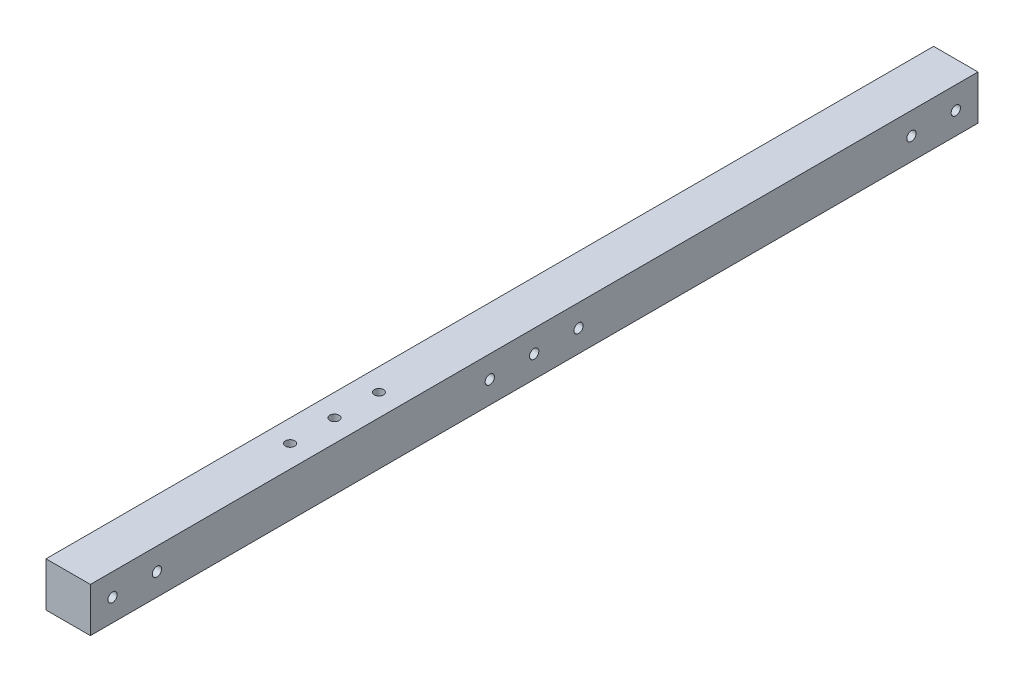
from build123d import *

# Parameters (mm, degrees)
SKETCH_1_W          = 20
SKETCH_1_H          = 20
EXTRUDE_1_DEPTH     = 400
SKETCH_2_R          = 2.1
CUT_EXTRUDE_1_DEPTH = 401.62451248
SKETCH_3_R          = 2.1
CUT_EXTRUDE_2_DEPTH = 401.62451248
SKETCH_4_R          = 2.1
CUT_EXTRUDE_3_DEPTH = 401.62451248


with BuildPart() as part:
    # 草图1 → 凸台-拉伸1 (new body)
    with BuildSketch(Plane.XY):
        Rectangle(SKETCH_1_W, SKETCH_1_H)
    extrude(amount=EXTRUDE_1_DEPTH)

    # 草图2 → 切除-拉伸1 (cut, through all)
    with BuildSketch(Plane(origin=(10, 0, 0), x_dir=(0, 0, -1), z_dir=(1, 0, 0))):
        with Locations((-10, 0)):
            Circle(SKETCH_2_R)
        with Locations((-30, 0)):
            Circle(SKETCH_2_R)
        with Locations(Location((-390, 0, 0), (0, 0, 180))):
            Circle(SKETCH_2_R)
        with Locations(Location((-370, 0, 0), (0, 0, 180))):
            Circle(SKETCH_2_R)
    extrude(amount=-CUT_EXTRUDE_1_DEPTH, mode=Mode.SUBTRACT)

    # 草图3 → 切除-拉伸2 (cut, through all)
    with BuildSketch(Plane(origin=(10, 0, 0), x_dir=(0, 0, -1), z_dir=(1, 0, 0))):
        with Locations((-220, 0)):
            Circle(SKETCH_3_R)
        with Locations((-200, 0)):
            Circle(SKETCH_3_R)
        with Locations((-180, 0)):
            Circle(SKETCH_3_R)
    extrude(amount=-CUT_EXTRUDE_2_DEPTH, mode=Mode.SUBTRACT)

    # 草图4 → 切除-拉伸3 (cut, through all)
    with BuildSketch(Plane.XZ.offset(10)):
        with Locations(Location((0, 300, 0), (0, 0, 270))):
            Circle(SKETCH_4_R)
        with Locations(Location((0, 280, 0), (0, 0, 270))):
            Circle(SKETCH_4_R)
        with Locations(Location((0, 260, 0), (0, 0, 270))):
            Circle(SKETCH_4_R)
    extrude(amount=-CUT_EXTRUDE_3_DEPTH, mode=Mode.SUBTRACT)


solid = part.part
